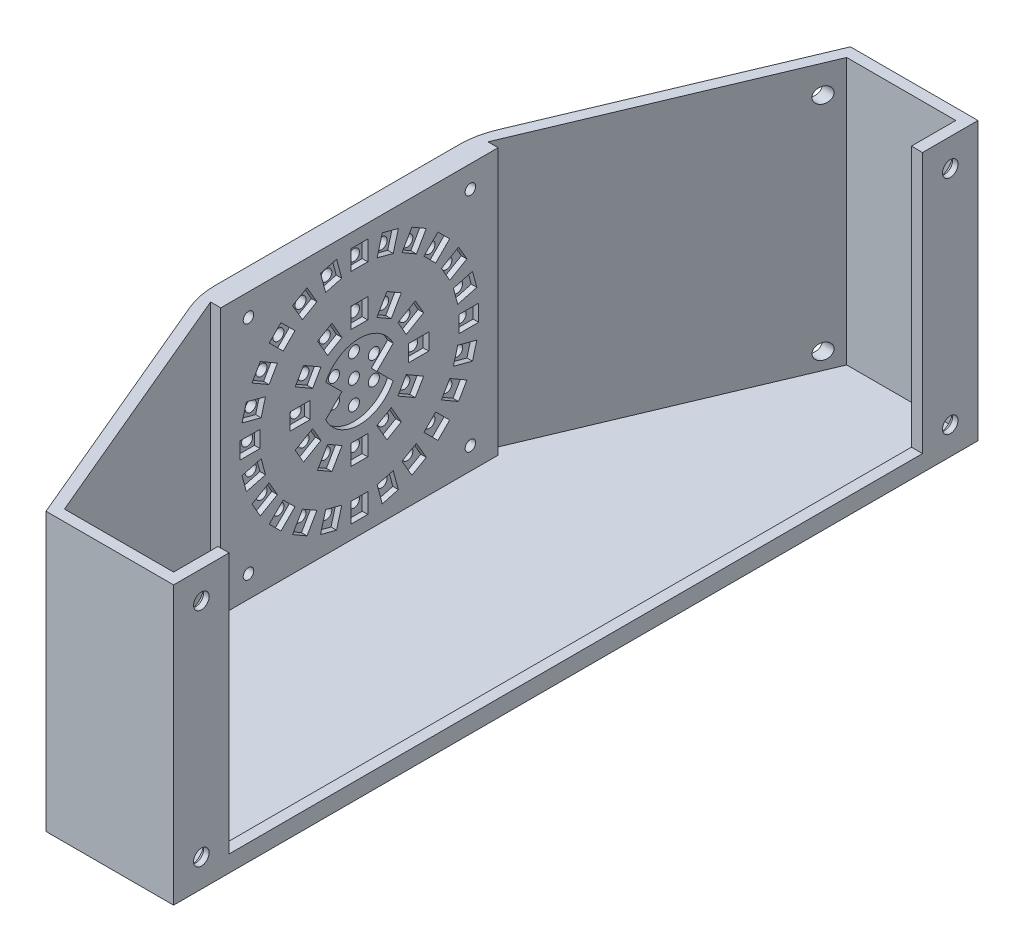
from build123d import *

# Parameters (mm, degrees)
EXTRUDE_1_DEPTH          = 4
SKETCH_2_W               = 6
SKETCH_2_H               = 290
EXTRUDE_2_DEPTH          = 4
EXTRUDE_1_2_DEPTH        = 96
SKETCH_29_W              = 8
SKETCH_29_H              = 100
EXTRUDE_5_DEPTH          = 96
SKETCH_20_W              = 6
SKETCH_20_H              = 7.125217771
SKETCH_20_W_2            = 7.125217771
SKETCH_20_H_2            = 6
SKETCH_20_H_3            = 7.251760651
SKETCH_20_W_3            = 7.251760651
CUT_EXTRUDE_7_DEPTH      = 2
CUT_EXTRUDE_6_DEPTH      = 197.012754687
CUT_EXTRUDE_6_DEPTH_BACK = 197.012754687
SKETCH_16_R              = 2.8
SKETCH_21_R              = 2
LED_DEPTH                = 10
FILLET_3_R               = 30
CHAMFER_2_SIZE           = 2
SKETCH_30_R              = 1.9
CUT_EXTRUDE_11_DEPTH     = 7
CHAMFER_3_SIZE           = 2
CHAMFER_4_SIZE           = 2
CHAMFER_6_SIZE           = 2
SKETCH_34_W              = 250
SKETCH_34_H              = 94
CUT_EXTRUDE_12_DEPTH     = 10


with BuildPart() as part:
    # Эскиз1 → Extrude 1 (new body)
    with BuildSketch(Plane(origin=(0, 0, 0), x_dir=(1, 0, 0), z_dir=(0, 1, 0))):
        Polygon((-60, -50), (-60, 50), (-20, 145), (20, 145), (20, -145), (-20, -145), align=None)
    extrude(amount=EXTRUDE_1_DEPTH)

    # Эскиз2 → Бобышка-Вытянуть2 (add)
    with BuildSketch(Plane(origin=(0, 0, 0), x_dir=(1, 0, 0), z_dir=(0, 1, 0))):
        with Locations((23, 0)):
            Rectangle(SKETCH_2_W, SKETCH_2_H)
    extrude(amount=EXTRUDE_2_DEPTH)

    # Эскиз17 → Extrude 1 2 (add)
    with BuildSketch(Plane(origin=(0, 4, 0), x_dir=(1, 0, 0), z_dir=(0, 1, 0))):
        Polygon((-20, 145), (-60, 50), (-60, -50), (-20, -145), (26, -145), (26, 145), align=None)
        Polygon((-17.344099341, 141), (-56, 49.192235936), (-56, -49.192235936), (-17.344099341, -141), (22, -141), (22, 141), align=None, mode=Mode.SUBTRACT)
    extrude(amount=EXTRUDE_1_2_DEPTH)

    # Эскиз29 → Бобышка-Вытянуть5 (add)
    with BuildSketch(Plane(origin=(0, 100, 0), x_dir=(1, 0, 0), z_dir=(0, 1, 0))):
        with Locations((-56, 0)):
            Rectangle(SKETCH_29_W, SKETCH_29_H)
    extrude(amount=-EXTRUDE_5_DEPTH)

    # Эскиз20 → Вырез-Вытянуть7 (cut)
    with BuildSketch(Plane(origin=(-52, 0, 0), x_dir=(0, 0, -1), z_dir=(1, 0, 0))):
        Polygon((8.231441461, 94.311267666), (6.387299401, 87.428835803), (12.182854359, 85.875921532), (14.026996418, 92.758353395), align=None)
        with BuildLine():
            Line((6.3, 52), (12.161242978, 57.861242978))
            ThreePointArc((12.161242978, 57.861242978), (0, 65.5), (-12.161242978, 57.861242978))
            Line((-12.161242978, 57.861242978), (-6.3, 52))
            Line((-6.3, 52), (-12.161242978, 46.138757022))
            ThreePointArc((-12.161242978, 46.138757022), (0, 38.5), (12.161242978, 46.138757022))
            Line((12.161242978, 46.138757022), (6.3, 52))
        make_face()
        with Locations((0, 91.437391115)):
            Rectangle(SKETCH_20_W, SKETCH_20_H)
        Polygon((18.901923789, 90.739092363), (15.339314903, 84.568472766), (20.535467326, 81.568472766), (24.098076211, 87.739092363), align=None)
        Polygon((28.284271247, 84.526911935), (23.245981444, 79.488622131), (27.488622131, 75.245981444), (32.526911935, 80.284271247), align=None)
        Polygon((35.739092363, 76.098076211), (29.568472766, 72.535467326), (32.568472766, 67.339314903), (38.739092363, 70.901923789), align=None)
        Polygon((40.758353395, 66.026996418), (33.875921532, 64.182854359), (35.428835803, 58.387299401), (42.311267666, 60.231441461), align=None)
        with Locations((39.437391115, 52)):
            Rectangle(SKETCH_20_W_2, SKETCH_20_H_2)
        Polygon((42.311267666, 43.768558539), (35.428835803, 45.612700599), (33.875921532, 39.817145641), (40.758353395, 37.973003582), align=None)
        Polygon((38.739092363, 33.098076211), (32.568472766, 36.660685097), (29.568472766, 31.464532674), (35.739092363, 27.901923789), align=None)
        Polygon((32.526911935, 23.715728753), (27.488622131, 28.754018556), (23.245981444, 24.511377869), (28.284271247, 19.473088065), align=None)
        Polygon((24.098076211, 16.260907637), (20.535467326, 22.431527234), (15.339314903, 19.431527234), (18.901923789, 13.260907637), align=None)
        Polygon((14.026996418, 11.241646605), (12.182854359, 18.124078468), (6.387299401, 16.571164197), (8.231441461, 9.688732334), align=None)
        with Locations((0, 12.562608886)):
            Rectangle(SKETCH_20_W, SKETCH_20_H)
        Polygon((-8.231441461, 9.688732334), (-6.387299401, 16.571164197), (-12.182854359, 18.124078468), (-14.026996418, 11.241646605), align=None)
        Polygon((-18.901923789, 13.260907637), (-15.339314903, 19.431527234), (-20.535467326, 22.431527234), (-24.098076211, 16.260907637), align=None)
        Polygon((-28.284271247, 19.473088065), (-23.245981444, 24.511377869), (-27.488622131, 28.754018556), (-32.526911935, 23.715728753), align=None)
        Polygon((-35.739092363, 27.901923789), (-29.568472766, 31.464532674), (-32.568472766, 36.660685097), (-38.739092363, 33.098076211), align=None)
        Polygon((-40.758353395, 37.973003582), (-33.875921532, 39.817145641), (-35.428835803, 45.612700599), (-42.311267666, 43.768558539), align=None)
        with Locations((-39.437391115, 52)):
            Rectangle(SKETCH_20_W_2, SKETCH_20_H_2)
        Polygon((-42.311267666, 60.231441461), (-35.428835803, 58.387299401), (-33.875921532, 64.182854359), (-40.758353395, 66.026996418), align=None)
        Polygon((-38.739092363, 70.901923789), (-32.568472766, 67.339314903), (-29.568472766, 72.535467326), (-35.739092363, 76.098076211), align=None)
        Polygon((-32.526911935, 80.284271247), (-27.488622131, 75.245981444), (-23.245981444, 79.488622131), (-28.284271247, 84.526911935), align=None)
        Polygon((-24.098076211, 87.739092363), (-20.535467326, 81.568472766), (-15.339314903, 84.568472766), (-18.901923789, 90.739092363), align=None)
        Polygon((-14.026996418, 92.758353395), (-12.182854359, 85.875921532), (-6.387299401, 87.428835803), (-8.231441461, 94.311267666), align=None)
        Polygon((6.276043463, 68.870426149), (9.901923789, 75.150635095), (15.098076211, 72.150635095), (11.472195886, 65.870426149), align=None)
        with Locations((0, 73.374119675)):
            Rectangle(SKETCH_20_W, SKETCH_20_H_3)
        Polygon((13.870426149, 63.472195886), (20.150635095, 67.098076211), (23.150635095, 61.901923789), (16.870426149, 58.276043463), align=None)
        with Locations((21.374119675, 52)):
            Rectangle(SKETCH_20_W_3, SKETCH_20_H_2)
        Polygon((16.870426149, 45.723956537), (23.150635095, 42.098076211), (20.150635095, 36.901923789), (13.870426149, 40.527804114), align=None)
        Polygon((11.472195886, 38.129573851), (15.098076211, 31.849364905), (9.901923789, 28.849364905), (6.276043463, 35.129573851), align=None)
        with Locations((0, 30.625880326)):
            Rectangle(SKETCH_20_W, SKETCH_20_H_3)
        Polygon((-6.276043463, 35.129573851), (-9.901923789, 28.849364905), (-15.098076211, 31.849364905), (-11.472195886, 38.129573851), align=None)
        Polygon((-13.870426149, 40.527804114), (-20.150635095, 36.901923789), (-23.150635095, 42.098076211), (-16.870426149, 45.723956537), align=None)
        with Locations((-21.374119675, 52)):
            Rectangle(SKETCH_20_W_3, SKETCH_20_H_2)
        Polygon((-16.870426149, 58.276043463), (-23.150635095, 61.901923789), (-20.150635095, 67.098076211), (-13.870426149, 63.472195886), align=None)
        Polygon((-11.472195886, 65.870426149), (-15.098076211, 72.150635095), (-9.901923789, 75.150635095), (-6.276043463, 68.870426149), align=None)
    extrude(amount=-CUT_EXTRUDE_7_DEPTH, mode=Mode.SUBTRACT)

    # Эскиз16 → Вырез-Вытянуть6 (cut, two sides: drawn at the far end of the back side and taken through both)
    with BuildSketch(Plane(origin=(26, 0, 0), x_dir=(0, 0, -1), z_dir=(1, 0, 0)).offset(-CUT_EXTRUDE_6_DEPTH_BACK)):
        with Locations(Location((135, 90, 0), (0, 0, 180))):
            Circle(SKETCH_16_R)
        with Locations(Location((135, 10, 0), (0, 0, 180))):
            Circle(SKETCH_16_R)
        with Locations(Location((-135, 90, 0), (0, 0, 180))):
            Circle(SKETCH_16_R)
        with Locations(Location((-135, 10, 0), (0, 0, 180))):
            Circle(SKETCH_16_R)
    extrude(amount=CUT_EXTRUDE_6_DEPTH + CUT_EXTRUDE_6_DEPTH_BACK, mode=Mode.SUBTRACT)

    # Эскиз21 → Отверстия под LED (cut)
    with BuildSketch(Plane(origin=(-52, 0, 0), x_dir=(0, 0, -1), z_dir=(1, 0, 0))):
        with Locations((0, 90.5)):
            Circle(SKETCH_21_R)
        with Locations((9.964533236, 89.188144312)):
            Circle(SKETCH_21_R)
        with Locations((19.25, 85.341978046)):
            Circle(SKETCH_21_R)
        with Locations((27.223611076, 79.223611076)):
            Circle(SKETCH_21_R)
        with Locations((33.341978046, 71.25)):
            Circle(SKETCH_21_R)
        with Locations((37.188144312, 61.964533236)):
            Circle(SKETCH_21_R)
        with Locations((38.5, 52)):
            Circle(SKETCH_21_R)
        with Locations((37.188144312, 42.035466764)):
            Circle(SKETCH_21_R)
        with Locations((33.341978046, 32.75)):
            Circle(SKETCH_21_R)
        with Locations((27.223611076, 24.776388924)):
            Circle(SKETCH_21_R)
        with Locations((19.25, 18.658021954)):
            Circle(SKETCH_21_R)
        with Locations((9.964533236, 14.811855688)):
            Circle(SKETCH_21_R)
        with Locations((0, 13.5)):
            Circle(SKETCH_21_R)
        with Locations((-9.964533236, 14.811855688)):
            Circle(SKETCH_21_R)
        with Locations((-19.25, 18.658021954)):
            Circle(SKETCH_21_R)
        with Locations((-27.223611076, 24.776388924)):
            Circle(SKETCH_21_R)
        with Locations((-33.341978046, 32.75)):
            Circle(SKETCH_21_R)
        with Locations((-37.188144312, 42.035466764)):
            Circle(SKETCH_21_R)
        with Locations((-38.5, 52)):
            Circle(SKETCH_21_R)
        with Locations((-37.188144312, 61.964533236)):
            Circle(SKETCH_21_R)
        with Locations((-33.341978046, 71.25)):
            Circle(SKETCH_21_R)
        with Locations((-27.223611076, 79.223611076)):
            Circle(SKETCH_21_R)
        with Locations((-19.25, 85.341978046)):
            Circle(SKETCH_21_R)
        with Locations((-9.964533236, 89.188144312)):
            Circle(SKETCH_21_R)
        with Locations((0, 73)):
            Circle(SKETCH_21_R)
        with Locations((10.5, 70.186533479)):
            Circle(SKETCH_21_R)
        with Locations((18.186533479, 62.5)):
            Circle(SKETCH_21_R)
        with Locations((21, 52)):
            Circle(SKETCH_21_R)
        with Locations((18.186533479, 41.5)):
            Circle(SKETCH_21_R)
        with Locations((10.5, 33.813466521)):
            Circle(SKETCH_21_R)
        with Locations((0, 31)):
            Circle(SKETCH_21_R)
        with Locations((-10.5, 33.813466521)):
            Circle(SKETCH_21_R)
        with Locations((-18.186533479, 41.5)):
            Circle(SKETCH_21_R)
        with Locations((-21, 52)):
            Circle(SKETCH_21_R)
        with Locations((-18.186533479, 62.5)):
            Circle(SKETCH_21_R)
        with Locations((-10.5, 70.186533479)):
            Circle(SKETCH_21_R)
        with Locations((0, 60.3)):
            Circle(SKETCH_21_R)
        with Locations((7.188010851, 56.15)):
            Circle(SKETCH_21_R)
        with Locations((7.188010851, 47.85)):
            Circle(SKETCH_21_R)
        with Locations((0, 43.7)):
            Circle(SKETCH_21_R)
        with Locations((-7.188010851, 47.85)):
            Circle(SKETCH_21_R)
        with Locations((-7.188010851, 56.15)):
            Circle(SKETCH_21_R)
        with Locations((0, 52)):
            Circle(SKETCH_21_R)
    extrude(amount=-LED_DEPTH, mode=Mode.SUBTRACT)

    # Скругление3
    fillet_3_edges = [part.edges().sort_by_distance(p)[0] for p in [
        (-60, 50, 50),
        (-60, 50, -50),
    ]]
    fillet(fillet_3_edges, radius=FILLET_3_R)

    # Фаска2
    chamfer_2_edges = [part.edges().sort_by_distance(p)[0] for p in [
        (-60, 32.75, 35.341978046),
        (-60, 42.035466764, 39.188144312),
        (-60, 52, 40.5),
        (-60, 61.964533236, 39.188144312),
        (-60, 71.25, 35.341978046),
        (-60, 79.223611076, 29.223611076),
        (-60, 85.341978046, 21.25),
        (-60, 89.188144312, 11.964533236),
        (-60, 24.776388924, 29.223611076),
        (-60, 18.658021954, 21.25),
        (-60, 14.811855688, 11.964533236),
        (-60, 13.5, 2),
        (-60, 14.811855688, -7.964533236),
        (-60, 18.658021954, -17.25),
        (-60, 24.776388924, -25.223611076),
        (-60, 32.75, -31.341978046),
        (-60, 42.035466764, -35.188144312),
        (-60, 52, -36.5),
        (-60, 61.964533236, -35.188144312),
        (-60, 71.25, -31.341978046),
        (-60, 79.223611076, -25.223611076),
        (-60, 85.341978046, -17.25),
        (-60, 89.188144312, -7.964533236),
        (-60, 90.5, 2),
    ]]
    chamfer(chamfer_2_edges, length=CHAMFER_2_SIZE)

    # Эскиз30 → Вырез-Вытянуть11 (cut)
    with BuildSketch(Plane(origin=(-52, 0, 0), x_dir=(0, 0, -1), z_dir=(1, 0, 0))):
        with Locations((-40, 92)):
            Circle(SKETCH_30_R)
        with Locations((40, 92)):
            Circle(SKETCH_30_R)
        with Locations((-40, 12)):
            Circle(SKETCH_30_R)
        with Locations((40, 12)):
            Circle(SKETCH_30_R)
    extrude(amount=-CUT_EXTRUDE_11_DEPTH, mode=Mode.SUBTRACT)

    # Фаска3
    chamfer_3_edges = [part.edges().sort_by_distance(p)[0] for p in [
        (-60, 60.3, 2),
        (-60, 56.15, 9.188010851),
        (-60, 47.85, 9.188010851),
        (-60, 43.7, 2),
        (-60, 47.85, -5.188010851),
        (-60, 56.15, -5.188010851),
        (-60, 52, 2),
    ]]
    chamfer(chamfer_3_edges, length=CHAMFER_3_SIZE)

    # Фаска4
    chamfer_4_edges = [part.edges().sort_by_distance(p)[0] for p in [
        (-60, 70.186533479, -8.5),
        (-60, 62.5, -16.186533479),
        (-60, 52, -19),
        (-60, 41.5, -16.186533479),
        (-60, 33.813466521, -8.5),
        (-60, 31, 2),
        (-60, 33.813466521, 12.5),
        (-60, 73, 2),
        (-60, 70.186533479, 12.5),
        (-60, 62.5, 20.186533479),
        (-60, 52, 23),
        (-60, 41.5, 20.186533479),
    ]]
    chamfer(chamfer_4_edges, length=CHAMFER_4_SIZE)

    # Фаска6
    chamfer_6_edges = [part.edges().sort_by_distance(p)[0] for p in [
        (22, 10, -137.8),
        (22, 10, 132.2),
        (22, 90, 132.2),
        (22, 90, -137.8),
    ]]
    chamfer(chamfer_6_edges, length=CHAMFER_6_SIZE)

    # Эскиз34 → Вырез-Вытянуть12 (cut)
    with BuildSketch(Plane(origin=(26, 0, 0), x_dir=(0, 0, -1), z_dir=(1, 0, 0))):
        with Locations((0, 53)):
            Rectangle(SKETCH_34_W, SKETCH_34_H)
    extrude(amount=-CUT_EXTRUDE_12_DEPTH, mode=Mode.SUBTRACT)


solid = part.part
